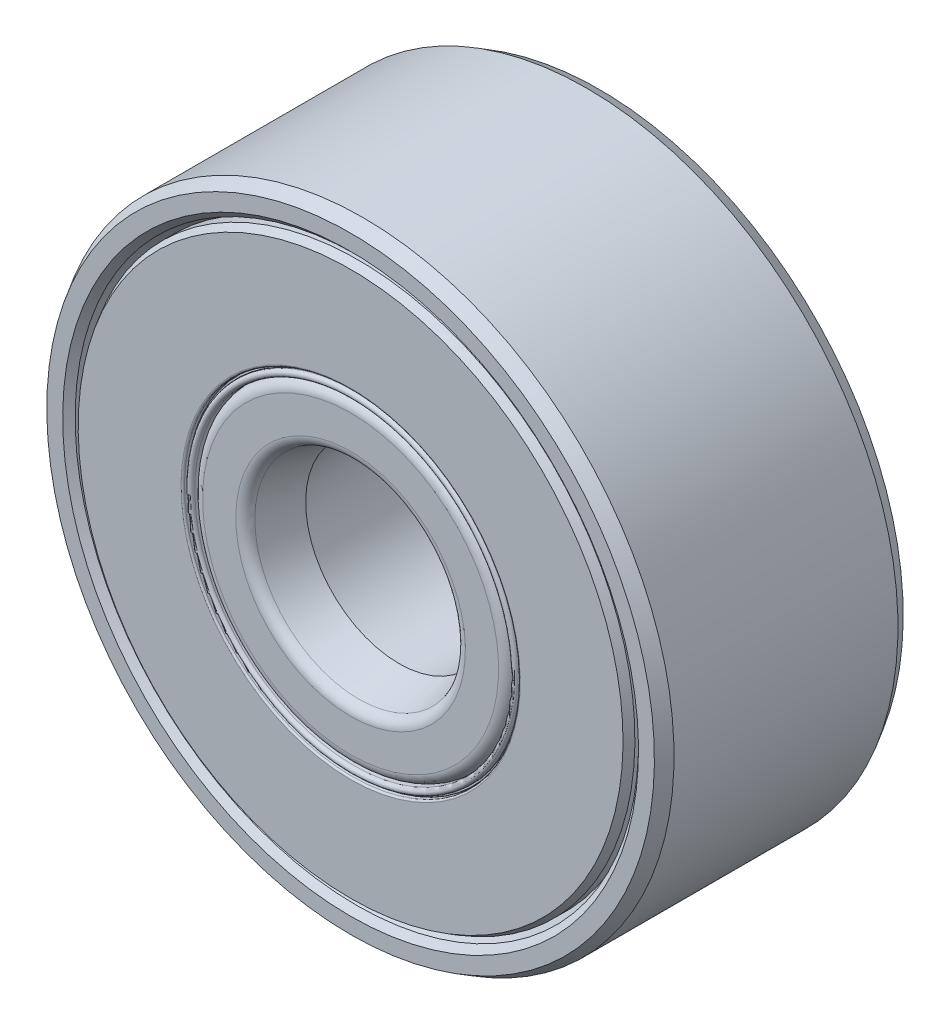
from build123d import *

# Parameters (mm, degrees)
CIRPATTERN1_COUNT = 7


with BuildPart() as part:
    # Sketch3 → Revolve1 (revolve)
    with BuildSketch(Plane(origin=(0, 0, 0), x_dir=(0, 0, -1), z_dir=(1, 0, 0)), mode=Mode.PRIVATE) as revolve1_sk:
        with BuildLine():
            Line((-1.682987285, 4.45), (-1.9, 4.528986169))
            Line((-1.9, 4.528986169), (-2, 4.628986169))
            Line((-2, 4.628986169), (-2, 4.884529946))
            Line((-2, 4.884529946), (-1.8, 5))
            Line((-1.8, 5), (1.8, 5))
            Line((1.8, 5), (2, 4.884529946))
            Line((2, 4.884529946), (2, 4.628986169))
            Line((2, 4.628986169), (1.9, 4.528986169))
            Line((1.9, 4.528986169), (1.682987285, 4.45))
            Line((1.682987285, 4.45), (0.90997558, 4.45))
            ThreePointArc((0.90997558, 4.45), (0, 4.816666667), (-0.90997558, 4.45))
            Line((-0.90997558, 4.45), (-1.682987285, 4.45))
        make_face()
    revolve(revolve1_sk.sketch.rotate(Axis((0, 0, 2), (0, 0, -1)), 180), axis=Axis((0, 0, 2), (0, 0, -1)))


with BuildPart() as body_2:
    # Sketch4 → Revolve2 (revolve)
    with BuildSketch(Plane(origin=(0, 0, 0), x_dir=(0, 0, -1), z_dir=(1, 0, 0)), mode=Mode.PRIVATE) as revolve2_sk:
        with BuildLine():
            Line((-1.22198259, 1.5), (-1.867316375, 1.672916667))
            ThreePointArc((-1.867316375, 1.672916667), (-1.963006837, 1.736854989), (-2, 1.845833333))
            Line((-2, 1.845833333), (-2, 2.379316827))
            ThreePointArc((-2, 2.379316827), (-1.947567279, 2.505900613), (-1.820983494, 2.558333333))
            Line((-1.820983494, 2.558333333), (-0.90997558, 2.558333333))
            ThreePointArc((-0.90997558, 2.558333333), (0, 2.191666667), (0.90997558, 2.558333333))
            Line((0.90997558, 2.558333333), (1.820983494, 2.558333333))
            ThreePointArc((1.820983494, 2.558333333), (1.947567279, 2.505900613), (2, 2.379316827))
            Line((2, 2.379316827), (2, 1.845833333))
            ThreePointArc((2, 1.845833333), (1.963006837, 1.736854989), (1.867316375, 1.672916667))
            Line((1.867316375, 1.672916667), (1.22198259, 1.5))
            Line((1.22198259, 1.5), (-1.22198259, 1.5))
        make_face()
    revolve(revolve2_sk.sketch.rotate(Axis((0, 0, 2), (0, 0, -1)), 180), axis=Axis((0, 0, 2), (0, 0, -1)))


with BuildPart() as body_3:
    # Sketch5 → Revolve3 (revolve)
    with BuildSketch(Plane(origin=(0, 0, 0), x_dir=(0, 0, -1), z_dir=(1, 0, 0))):
        with BuildLine():
            Line((-1.3125, 3.504166667), (1.3125, 3.504166667))
            ThreePointArc((1.3125, 3.504166667), (0, 4.816666667), (-1.3125, 3.504166667))
        make_face()
    revolve(axis=Axis((0, 3.504166667, 1.3125), (0, 0, -1)))


with BuildPart() as cirpattern1_1:
    # CirPattern1: pattern copy
    add(body_3.part.rotate(Axis((0, 0, 0), (0, 0, 1)), 1 * 360 / CIRPATTERN1_COUNT))


with BuildPart() as cirpattern1_2:
    # CirPattern1: pattern copy
    add(body_3.part.rotate(Axis((0, 0, 0), (0, 0, 1)), 2 * 360 / CIRPATTERN1_COUNT))


with BuildPart() as cirpattern1_3:
    # CirPattern1: pattern copy
    add(body_3.part.rotate(Axis((0, 0, 0), (0, 0, 1)), 3 * 360 / CIRPATTERN1_COUNT))


with BuildPart() as cirpattern1_4:
    # CirPattern1: pattern copy
    add(body_3.part.rotate(Axis((0, 0, 0), (0, 0, 1)), 4 * 360 / CIRPATTERN1_COUNT))


with BuildPart() as cirpattern1_5:
    # CirPattern1: pattern copy
    add(body_3.part.rotate(Axis((0, 0, 0), (0, 0, 1)), 5 * 360 / CIRPATTERN1_COUNT))


with BuildPart() as cirpattern1_6:
    # CirPattern1: pattern copy
    add(body_3.part.rotate(Axis((0, 0, 0), (0, 0, 1)), 6 * 360 / CIRPATTERN1_COUNT))


with BuildPart() as body_10:
    # Sketch6 → Revolve4 (revolve)
    with BuildSketch(Plane(origin=(0, 0, 0), x_dir=(0, 0, -1), z_dir=(1, 0, 0)), mode=Mode.PRIVATE) as revolve4_sk:
        with BuildLine():
            Line((-1.878756443, 4.45), (-1.3125, 4.45))
            Line((-1.3125, 4.45), (-1.3125, 2.698333333))
            Line((-1.3125, 2.698333333), (-1.972, 2.698333333))
            ThreePointArc((-1.972, 2.698333333), (-1.99179899, 2.706534343), (-2, 2.726333333))
            Line((-2, 2.726333333), (-2, 4.38))
            Line((-2, 4.38), (-1.878756443, 4.45))
        make_face()
        with BuildLine():
            Line((1.972, 2.698333333), (1.3125, 2.698333333))
            Line((1.3125, 2.698333333), (1.3125, 4.45))
            Line((1.3125, 4.45), (1.878756443, 4.45))
            Line((1.878756443, 4.45), (2, 4.38))
            Line((2, 4.38), (2, 2.726333333))
            ThreePointArc((2, 2.726333333), (1.99179899, 2.706534343), (1.972, 2.698333333))
        make_face()
    revolve(revolve4_sk.sketch.rotate(Axis((0, 0, 2), (0, 0, -1)), 180), axis=Axis((0, 0, 2), (0, 0, -1)))


with BuildPart() as body_11:
    # Sketch7 → Revolve5 (revolve)
    with BuildSketch(Plane(origin=(0, 0, 0), x_dir=(0, 0, -1), z_dir=(1, 0, 0)), mode=Mode.PRIVATE) as revolve5_sk:
        with BuildLine():
            Line((-1.3125, 2.698333333), (-1.890562103, 2.698333333))
            Line((-1.890562103, 2.698333333), (-1.925030375, 2.692255647))
            ThreePointArc((-1.925030375, 2.692255647), (-1.937016396, 2.67663516), (-1.9225, 2.663333333))
            Line((-1.9225, 2.663333333), (-1.9475, 2.663333333))
            ThreePointArc((-1.9475, 2.663333333), (-2, 2.610833333), (-1.9475, 2.558333333))
            Line((-1.9475, 2.558333333), (-1.3125, 2.558333333))
            Line((-1.3125, 2.558333333), (-1.3125, 2.698333333))
        make_face()
    revolve(revolve5_sk.sketch.rotate(Axis((0, 0, 2), (0, 0, -1)), 180), axis=Axis((0, 0, 2), (0, 0, -1)))


solid = Compound([part.part, body_2.part, body_3.part, cirpattern1_1.part, cirpattern1_2.part, cirpattern1_3.part, cirpattern1_4.part, cirpattern1_5.part, cirpattern1_6.part, body_10.part, body_11.part])
